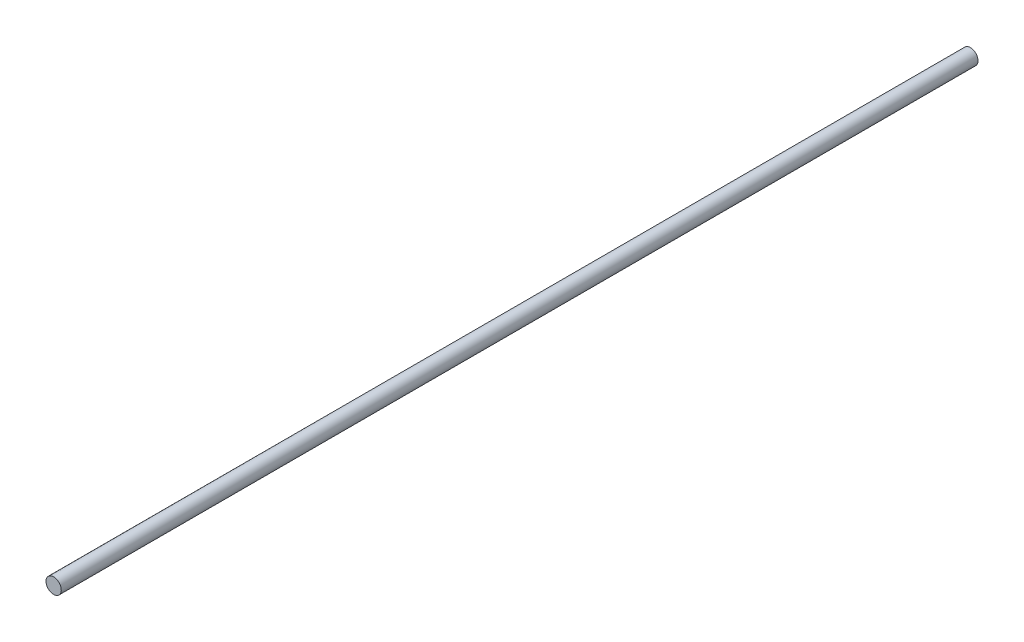
from build123d import *

# Parameters (mm, degrees)
SKETCH_1_R      = 5
EXTRUDE_1_DEPTH = 600


with BuildPart() as part:
    # 草图1 → 凸台-拉伸1 (new body)
    with BuildSketch(Plane.XY):
        Circle(SKETCH_1_R)
    extrude(amount=EXTRUDE_1_DEPTH)


solid = part.part
